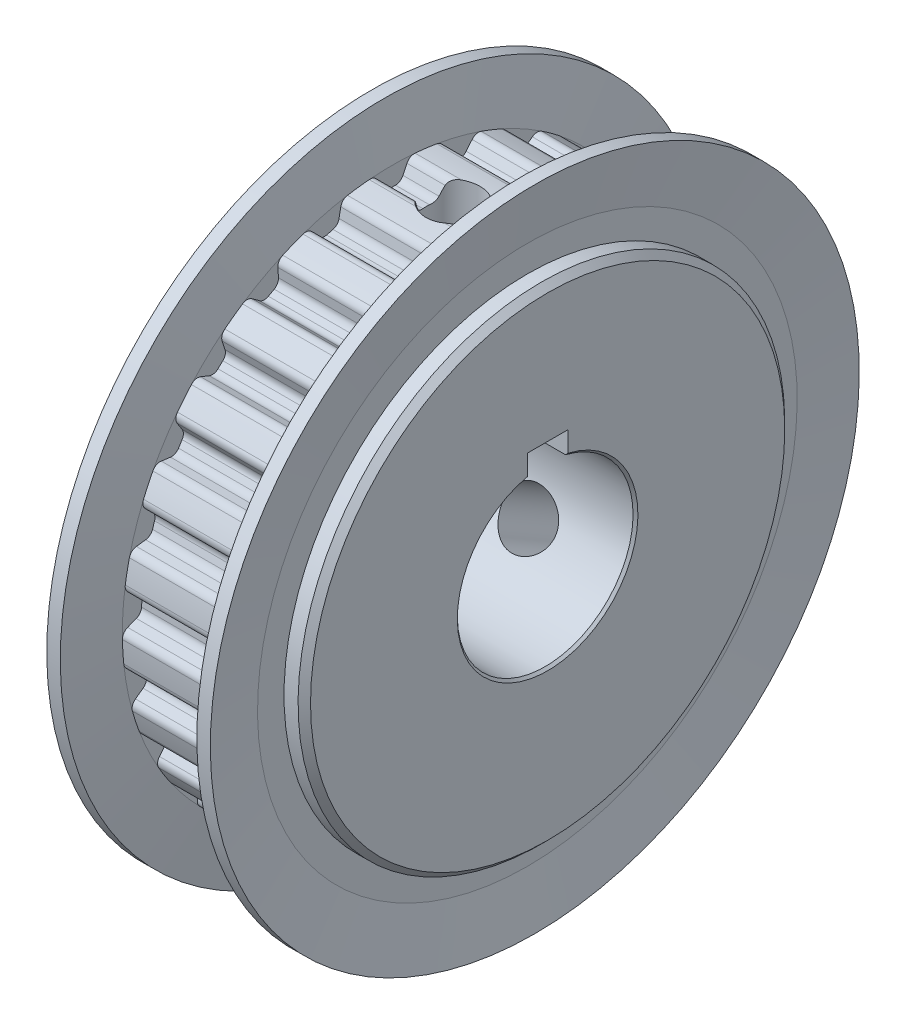
from build123d import *

# Parameters (mm, degrees)
CUT_EXTRUDE_START        = 11.5
CUT_EXTRUDE_1_DEPTH      = 9
PATTERN_CIRCULAR_1_COUNT = 25
SKETCH_6_R               = 6.5
CUT_EXTRUDE_2_DEPTH      = 37.715119501
CHAMFER_1_SIZE           = 0.18
SKETCH_7_W               = 3
SKETCH_7_H               = 1.691900757
CUT_EXTRUDE_1_2_DEPTH    = 14
SKETCH_11_W              = 2
SKETCH_11_H              = 19.96
PATTERN_CIRCULAR_2_COUNT = 2
PATTERN_CIRCULAR_2_ANGLE = 120


with BuildPart() as part:
    # 草图3 → 旋转1 (revolve)
    with BuildSketch(Plane.XY):
        Polygon((0, 0), (0, 17.54), (0.46, 18), (2.5, 18), (2.5, 19.96), (11.5, 19.96), (11.5, 18), (13.54, 18), (14, 17.54), (14, 0), align=None)
    revolve(axis=Axis((14, 0, 0), (-1, 0, 0)))

    # 草图4 → Cut-Extrude 1 (cut)
    with BuildSketch(Plane(origin=(0, 0, 0), x_dir=(0, 0, -1), z_dir=(1, 0, 0)).offset(CUT_EXTRUDE_START)):
        with BuildLine():
            Line((-0.246387141, 18.56), (0.246387141, 18.56))
            ThreePointArc((0.246387141, 18.56), (0.574139902, 18.655531218), (0.799234891, 18.91220286))
            Line((0.799234891, 18.91220286), (1.090977728, 19.537847394))
            ThreePointArc((1.090977728, 19.537847394), (1.338241464, 19.807988139), (1.695646333, 19.88784512))
            ThreePointArc((1.695646333, 19.88784512), (0, 19.96), (-1.695646333, 19.88784512))
            ThreePointArc((-1.695646333, 19.88784512), (-1.338241464, 19.807988139), (-1.090977728, 19.537847394))
            Line((-1.090977728, 19.537847394), (-0.799234891, 18.91220286))
            ThreePointArc((-0.799234891, 18.91220286), (-0.574139902, 18.655531218), (-0.246387141, 18.56))
        make_face()
    cut_extrude_1 = extrude(amount=-CUT_EXTRUDE_1_DEPTH, mode=Mode.SUBTRACT)

    # 阵列(圆周)1: Cut-Extrude 1 ×25 about axis
    pattern_circular_1_axis = Axis((0, 0, 0), (1, 0, 0))
    for i in range(1, PATTERN_CIRCULAR_1_COUNT):
        add(cut_extrude_1.rotate(pattern_circular_1_axis, i * 360 / PATTERN_CIRCULAR_1_COUNT), mode=Mode.SUBTRACT)

    # 草图5 → 旋转2 (revolve)
    with BuildSketch(Plane.XY, mode=Mode.PRIVATE) as revolve_2_sk:
        Polygon((1.95, 24), (2.5, 19.96), (2.5, 18), (1.5, 18), (1.5, 19.96), (0.95, 24), align=None)
        Polygon((12.5, 18), (11.5, 18), (11.5, 19.96), (12.05, 24), (13.05, 24), (12.5, 19.96), align=None)
    revolve(revolve_2_sk.sketch.rotate(Axis((0, 0, 0), (1, 0, 0)), 180), axis=Axis((0, 0, 0), (1, 0, 0)))

    # 草图6 → 切除-拉伸2 (cut, through all)
    with BuildSketch(Plane(origin=(0, 0, 0), x_dir=(0, 0, -1), z_dir=(1, 0, 0))):
        Circle(SKETCH_6_R)
    extrude(amount=CUT_EXTRUDE_2_DEPTH, mode=Mode.SUBTRACT)

    # 倒角1
    chamfer_1_edges = [part.edges().sort_by_distance(p)[0] for p in [
        (0, 0, 6.5),
        (14, 0, 6.5),
    ]]
    chamfer(chamfer_1_edges, length=CHAMFER_1_SIZE)

    # 草图7 → Cut-Extrude 1 2 (cut)
    with BuildSketch(Plane(origin=(0, 0, 0), x_dir=(0, 0, -1), z_dir=(1, 0, 0))):
        with Locations((0, 7.170505699)):
            Rectangle(SKETCH_7_W, SKETCH_7_H)
    extrude(amount=CUT_EXTRUDE_1_2_DEPTH, mode=Mode.SUBTRACT)

    # 草图11 → 切除-旋转5 (revolve, cut)
    with BuildSketch(Plane.XY, mode=Mode.PRIVATE) as cut_revolve_5_sk:
        with Locations((8, 9.98)):
            Rectangle(SKETCH_11_W, SKETCH_11_H)
    cut_revolve_5 = revolve(cut_revolve_5_sk.sketch.rotate(Axis((7, 19.96, 0), (0, -1, 0)), 172.923551304), axis=Axis((7, 19.96, 0), (0, -1, 0)), mode=Mode.SUBTRACT)

    # 阵列(圆周)2: 切除-旋转5 ×2 about axis
    pattern_circular_2_axis = Axis((14, 0, 0), (-1, 0, 0))
    for i in range(1, PATTERN_CIRCULAR_2_COUNT):
        add(cut_revolve_5.rotate(pattern_circular_2_axis, i * PATTERN_CIRCULAR_2_ANGLE / (PATTERN_CIRCULAR_2_COUNT - 1)), mode=Mode.SUBTRACT)


solid = part.part
